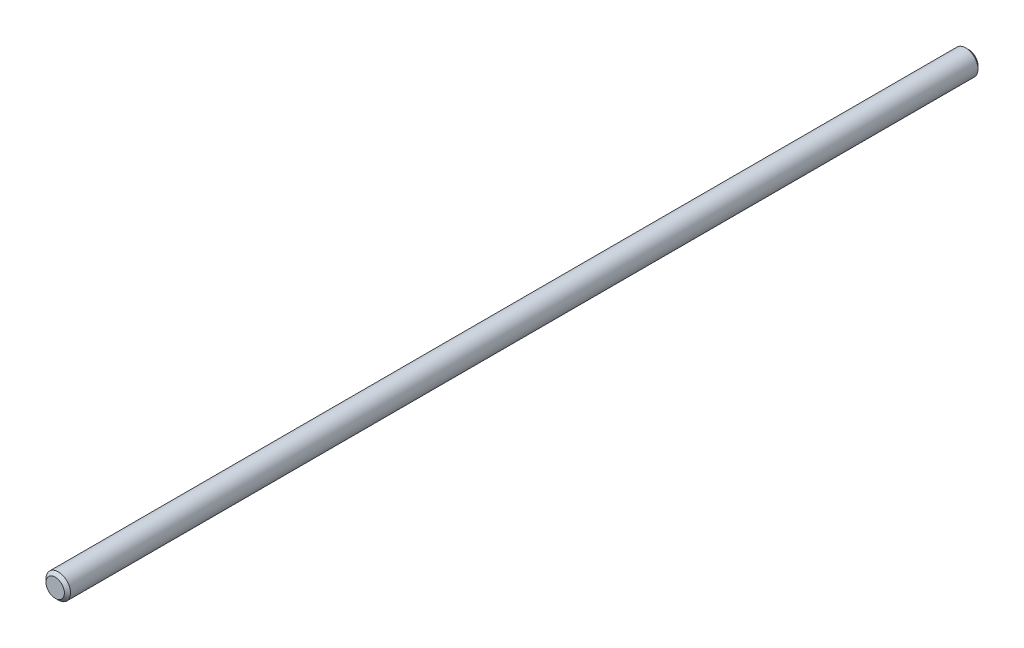
from build123d import *

# Parameters (mm, degrees)
SKETCH1_R           = 4
BOSS_EXTRUDE1_DEPTH = 298
CHAMFER1_SIZE       = 1


with BuildPart() as part:
    # Sketch1 → Boss-Extrude1 (new body)
    with BuildSketch(Plane.XY):
        Circle(SKETCH1_R)
    extrude(amount=BOSS_EXTRUDE1_DEPTH)

    # Chamfer1
    chamfer1_edges = [part.edges().sort_by_distance(p)[0] for p in [
        (-4, 0, 0),
        (-4, 0, 298),
    ]]
    chamfer(chamfer1_edges, length=CHAMFER1_SIZE)


solid = part.part
